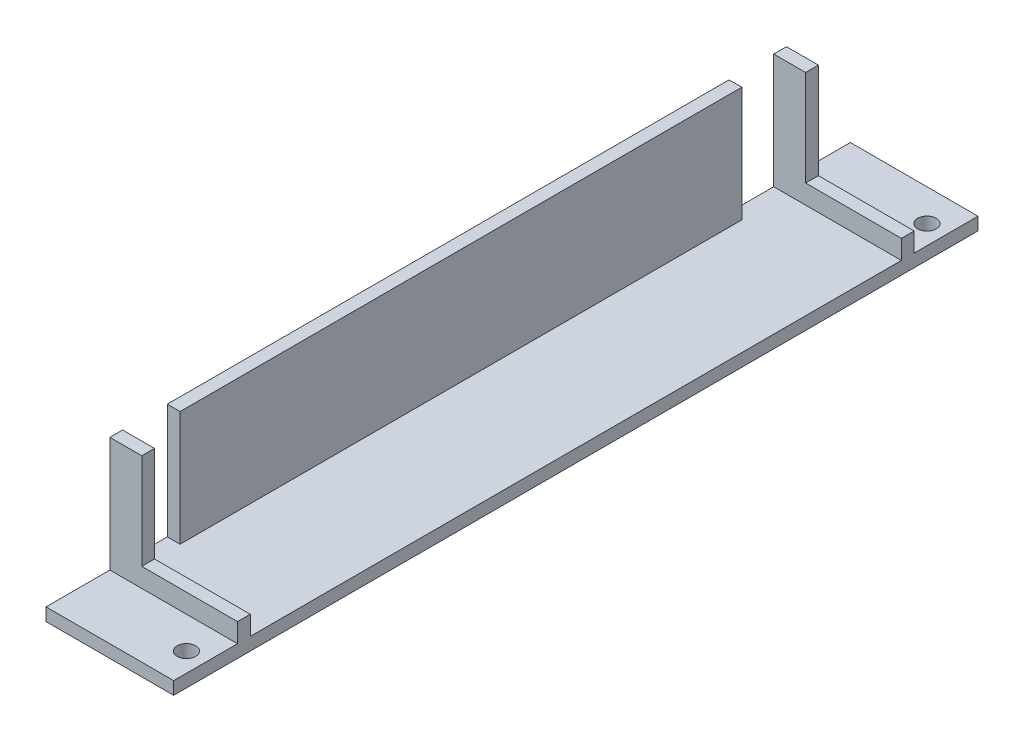
from build123d import *

# Parameters (mm, degrees)
BOSS_EXTRUDE1_DEPTH    = 126
SKETCH2_W              = 7
SKETCH2_H              = 18
SKETCH2_W_2            = 10
CUT_EXTRUDE1_DEPTH     = 130.135587659
BOSS_EXTRUDE2_DEPTH    = 2
M2_5_CLEARANCE_HOLE1_D = 2.9


with BuildPart() as part:
    # Sketch1 → Boss-Extrude1 (new body)
    with BuildSketch(Plane.XY):
        Polygon((-10, 0), (10, 0), (10, 2), (-8, 2), (-8, 20), (-10, 20), align=None)
    extrude(amount=BOSS_EXTRUDE1_DEPTH)

    # Sketch2 → Cut-Extrude1 (cut, through all)
    with BuildSketch(Plane.ZY.offset(10)):
        with Locations((15.5, 11)):
            Rectangle(SKETCH2_W, SKETCH2_H)
        with Locations((110.5, 11)):
            Rectangle(SKETCH2_W, SKETCH2_H)
        with Locations((5, 11)):
            Rectangle(SKETCH2_W_2, SKETCH2_H)
        with Locations((121, 11)):
            Rectangle(SKETCH2_W_2, SKETCH2_H)
    extrude(amount=-CUT_EXTRUDE1_DEPTH, mode=Mode.SUBTRACT)

    # Sketch3 → Boss-Extrude2 (add)
    with BuildSketch(Plane.XY.offset(116)):
        Polygon((-10, 20), (-5, 20), (-5, 5), (10, 5), (10, 2), (-5, 2), (-10, 2), align=None)
    boss_extrude2 = extrude(amount=-BOSS_EXTRUDE2_DEPTH)

    # M2.5 Clearance Hole1 (through all)
    with Locations(Plane(origin=(0, 2, 0), x_dir=(1, 0, 0), z_dir=(0, 1, 0))):
        with Locations((7, -121)):
            m2_5_clearance_hole1 = Hole(M2_5_CLEARANCE_HOLE1_D / 2)

    # Mirror1: Boss-Extrude2, M2.5 Clearance Hole1 across plane
    add(boss_extrude2.mirror(Plane.XY.offset(63)))
    add(m2_5_clearance_hole1.mirror(Plane.XY.offset(63)), mode=Mode.SUBTRACT)


solid = part.part
